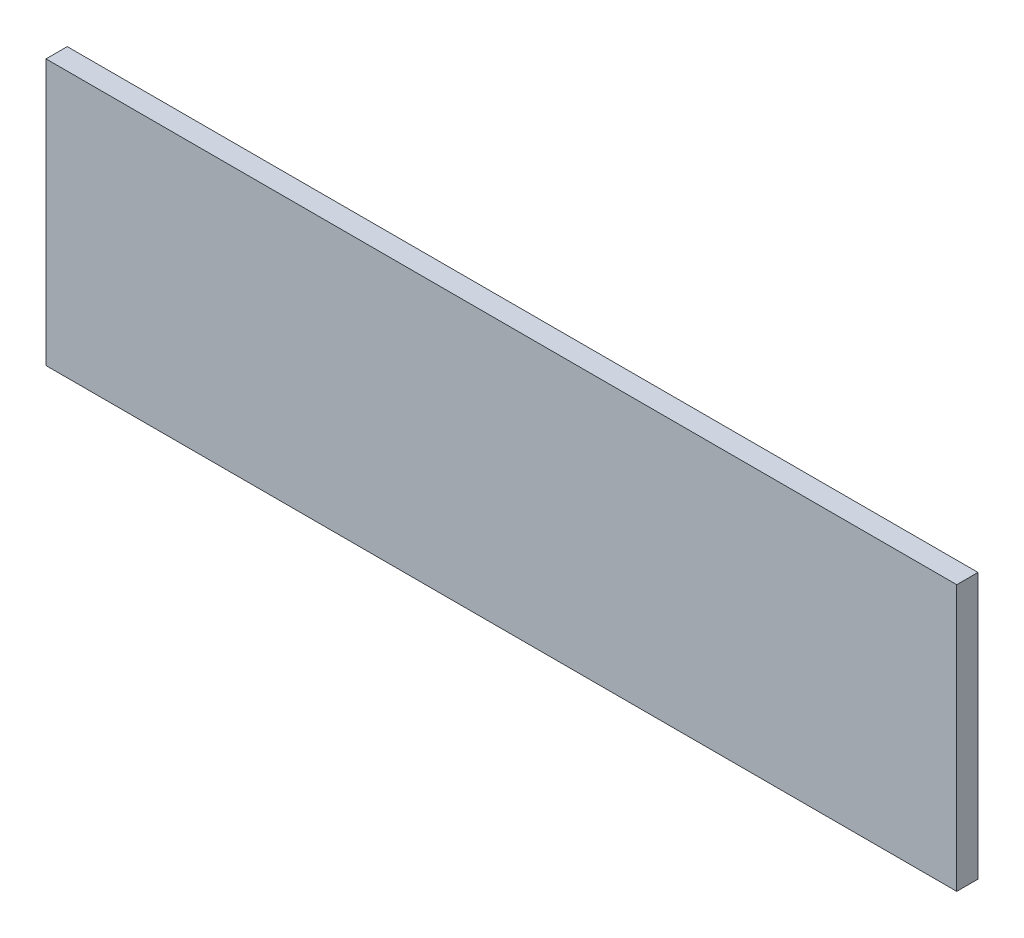
from build123d import *

# Parameters (mm, degrees)
SKETCH1_W           = 609.6
SKETCH1_H           = 177.8
BOSS_EXTRUDE1_DEPTH = 14.224


with BuildPart() as part:
    # Sketch1 → Boss-Extrude1 (new body)
    with BuildSketch(Plane.XY):
        Rectangle(SKETCH1_W, SKETCH1_H)
    extrude(amount=BOSS_EXTRUDE1_DEPTH)


solid = part.part
